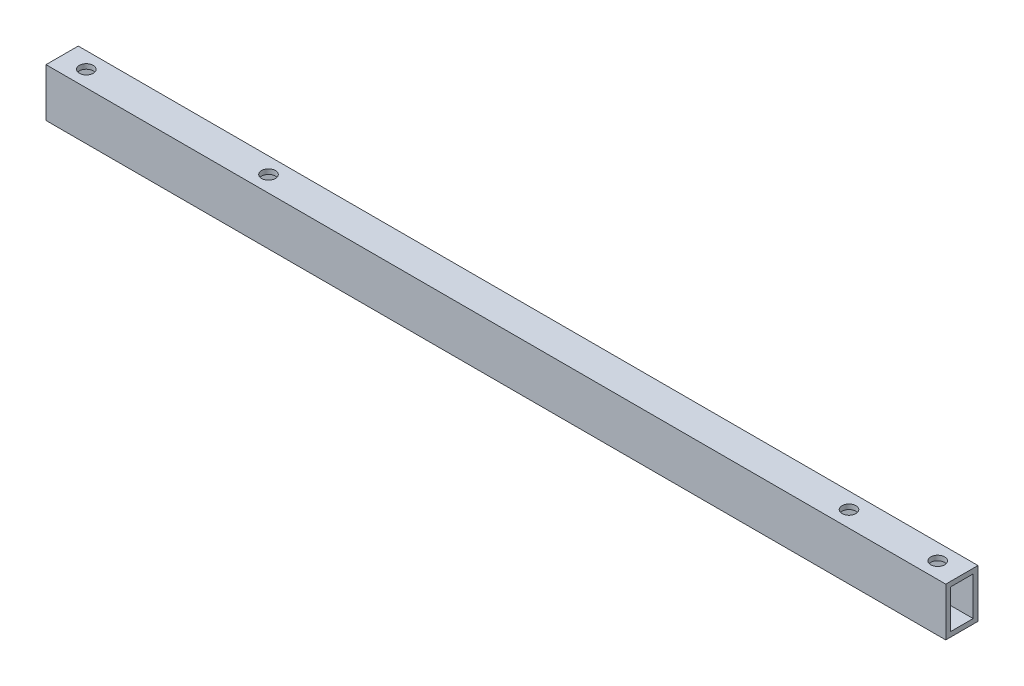
from build123d import *

# Parameters (mm, degrees)
SKETCH_1_W          = 10
SKETCH_1_H          = 15
SKETCH_1_W_2        = 7
SKETCH_1_H_2        = 12
EXTRUDE_1_DEPTH     = 279
SKETCH_2_R          = 2.15
CUT_EXTRUDE_1_DEPTH = 280.44766952


with BuildPart() as part:
    # ｽｹｯﾁ1 → 押し出し-薄板1 (new body)
    with BuildSketch(Plane(origin=(0, 0, 0), x_dir=(0, 0, -1), z_dir=(1, 0, 0))):
        Rectangle(SKETCH_1_W, SKETCH_1_H)
        Rectangle(SKETCH_1_W_2, SKETCH_1_H_2, mode=Mode.SUBTRACT)
    extrude(amount=EXTRUDE_1_DEPTH)

    # ｽｹｯﾁ2 → ｶｯﾄ - 押し出し1 (cut, through all)
    with BuildSketch(Plane(origin=(0, 7.5, 0), x_dir=(1, 0, 0), z_dir=(0, 1, 0))):
        with Locations(Location((271.5, 0, 0), (0, 0, 270))):
            Circle(SKETCH_2_R)
        with Locations(Location((7.5, 0, 0), (0, 0, 270))):
            Circle(SKETCH_2_R)
        with Locations(Location((64, 0, 0), (0, 0, 270))):
            Circle(SKETCH_2_R)
        with Locations(Location((244, 0, 0), (0, 0, 270))):
            Circle(SKETCH_2_R)
    extrude(amount=-CUT_EXTRUDE_1_DEPTH, mode=Mode.SUBTRACT)


solid = part.part
